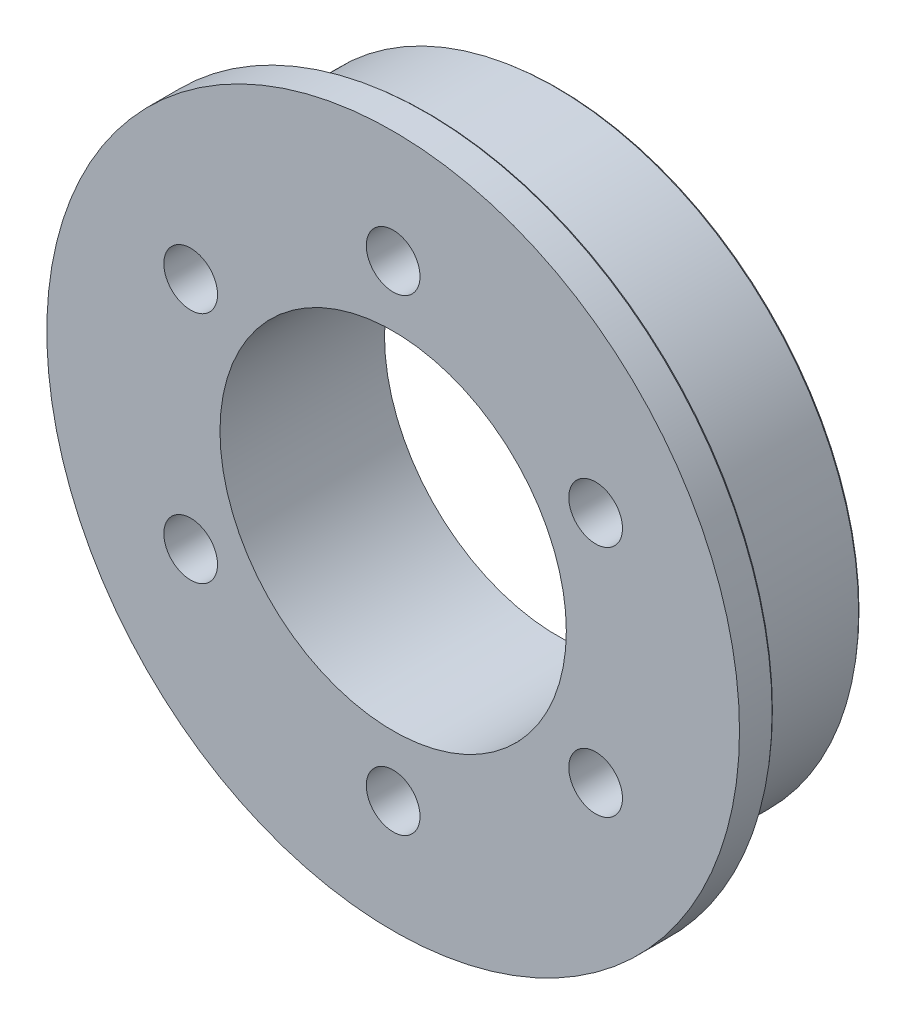
from build123d import *
from OCP.BRepFilletAPI import BRepFilletAPI_MakeChamfer

# Parameters (mm, degrees)
SKETCH_1_R          = 17.5
SKETCH_1_R_2        = 1.55
EXTRUDE_1_DEPTH     = 7.5
SKETCH_2_R          = 20
SKETCH_2_R_2        = 1.55
EXTRUDE_2_DEPTH     = 2
CHAMFER_1_SIZE      = 0.1
CHAMFER_1_SIZE2     = 0.119175359
SKETCH_4_R          = 10
CUT_EXTRUDE_1_DEPTH = 25


with BuildPart() as part:
    # 草图1 → 凸台-拉伸1 (new body)
    with BuildSketch(Plane.XY):
        Circle(SKETCH_1_R)
        with Locations((0, 13.5)):
            Circle(SKETCH_1_R_2, mode=Mode.SUBTRACT)
        with Locations((11.691342951, 6.75)):
            Circle(SKETCH_1_R_2, mode=Mode.SUBTRACT)
        with Locations((11.691342951, -6.75)):
            Circle(SKETCH_1_R_2, mode=Mode.SUBTRACT)
        with Locations((0, -13.5)):
            Circle(SKETCH_1_R_2, mode=Mode.SUBTRACT)
        with Locations((-11.691342951, -6.75)):
            Circle(SKETCH_1_R_2, mode=Mode.SUBTRACT)
        with Locations((-11.691342951, 6.75)):
            Circle(SKETCH_1_R_2, mode=Mode.SUBTRACT)
    extrude(amount=EXTRUDE_1_DEPTH)

    # 草图2 → 凸台-拉伸2 (add)
    with BuildSketch(Plane.XY.offset(7.5)):
        Circle(SKETCH_2_R)
        with Locations((11.691342951, 6.75)):
            Circle(SKETCH_2_R_2, mode=Mode.SUBTRACT)
        with Locations((11.691342951, -6.75)):
            Circle(SKETCH_2_R_2, mode=Mode.SUBTRACT)
        with Locations((0, -13.5)):
            Circle(SKETCH_2_R_2, mode=Mode.SUBTRACT)
        with Locations((-11.691342951, -6.75)):
            Circle(SKETCH_2_R_2, mode=Mode.SUBTRACT)
        with Locations((-11.691342951, 6.75)):
            Circle(SKETCH_2_R_2, mode=Mode.SUBTRACT)
        with Locations((0, 13.5)):
            Circle(SKETCH_2_R_2, mode=Mode.SUBTRACT)
    extrude(amount=EXTRUDE_2_DEPTH)

    # 倒角1: one chamfer whose edges measure the first distance from different faces: ONE call of the kernel's chamfer builder (chamfer() names one face for all edges)
    chamfer_1_edges_1 = [part.edges().sort_by_distance(p)[0] for p in [
        (-17.5, 0, 0),
    ]]
    chamfer_1_side_1 = [part.faces().sort_by_distance(p)[0] for p in [
        (0, 0, 0),
    ]]
    chamfer_1_edges_2 = [part.edges().sort_by_distance(p)[0] for p in [
        (-20, 0, 7.5),
    ]]
    chamfer_1_side_2 = [part.faces().sort_by_distance(p)[0] for p in [
        (-19.434314575, 0, 7.5),
    ]]
    chamfer_1 = BRepFilletAPI_MakeChamfer(part.part.solid().wrapped)
    for e in chamfer_1_edges_1:
        chamfer_1.Add(CHAMFER_1_SIZE, CHAMFER_1_SIZE2, e.wrapped, chamfer_1_side_1[0].wrapped)  # the first distance lies on this face
    for e in chamfer_1_edges_2:
        chamfer_1.Add(CHAMFER_1_SIZE, CHAMFER_1_SIZE2, e.wrapped, chamfer_1_side_2[0].wrapped)  # the first distance lies on this face
    add(Compound.cast(chamfer_1.Shape()), mode=Mode.REPLACE)

    # 草图4 → 切除-拉伸1 (cut)
    with BuildSketch(Plane(origin=(0, 0, 0), x_dir=(-1, 0, 0), z_dir=(0, 0, -1))):
        Circle(SKETCH_4_R)
    extrude(amount=-CUT_EXTRUDE_1_DEPTH, mode=Mode.SUBTRACT)


solid = part.part
